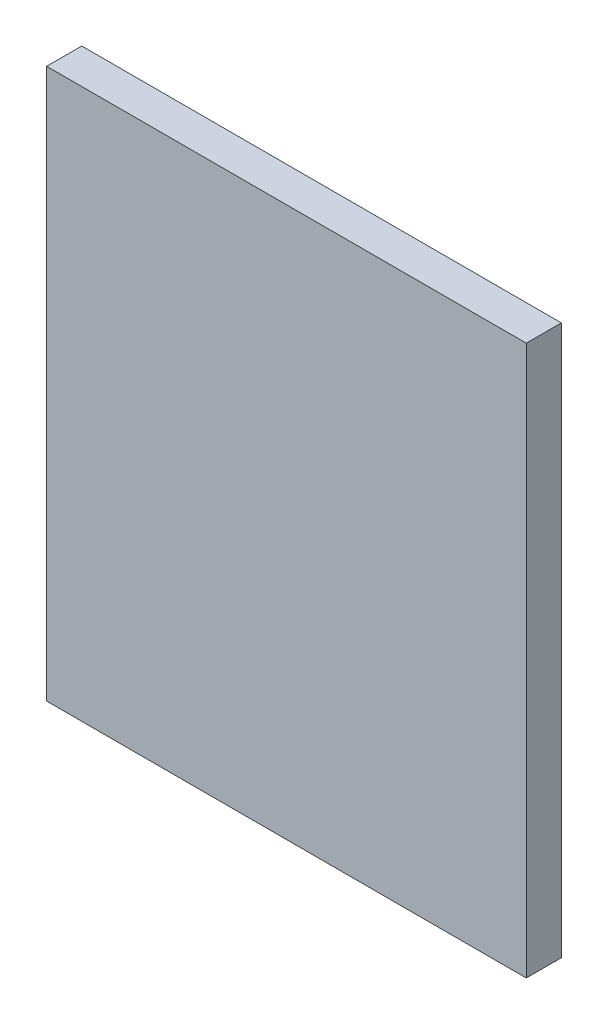
from build123d import *

# Parameters (mm, degrees)
SKETCH1_W           = 410
SKETCH1_H           = 470
BOSS_EXTRUDE1_DEPTH = 30


with BuildPart() as part:
    # Sketch1 → Boss-Extrude1 (new body)
    with BuildSketch(Plane.XY):
        with Locations((42.312362031, 78.421633554)):
            Rectangle(SKETCH1_W, SKETCH1_H)
    extrude(amount=BOSS_EXTRUDE1_DEPTH)


solid = part.part
